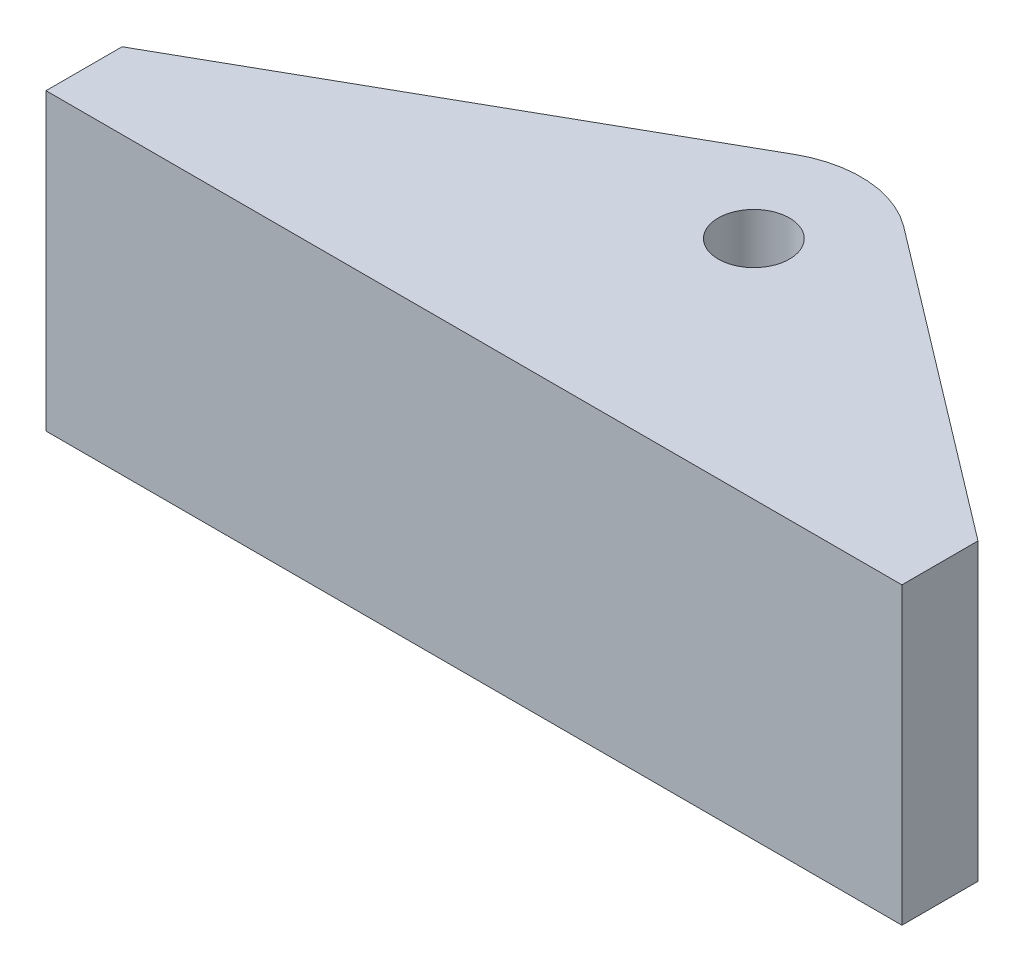
from build123d import *

# Parameters (mm, degrees)
SKETCH1_R           = 2.38125
BOSS_EXTRUDE1_DEPTH = 19.685


with BuildPart() as part:
    # Sketch1 → Boss-Extrude1 (new body)
    with BuildSketch(Plane(origin=(0, 0, 0), x_dir=(1, 0, 0), z_dir=(0, 1, 0))):
        with BuildLine():
            Line((0, 5.08), (28.663800302, 21.298712681))
            ThreePointArc((28.663800302, 21.298712681), (32.663285963, 22.208755547), (36.504040521, 20.769079194))
            Line((36.504040521, 20.769079194), (57.15, 5.08))
            Line((57.15, 5.08), (57.15, 0))
            Line((57.15, 0), (0, 0))
            Line((0, 0), (0, 5.08))
        make_face()
        with Locations(Location((32.1818, 15.08125, 0), (0, 0, 270))):
            Circle(SKETCH1_R, mode=Mode.SUBTRACT)
    extrude(amount=-BOSS_EXTRUDE1_DEPTH)


solid = part.part
